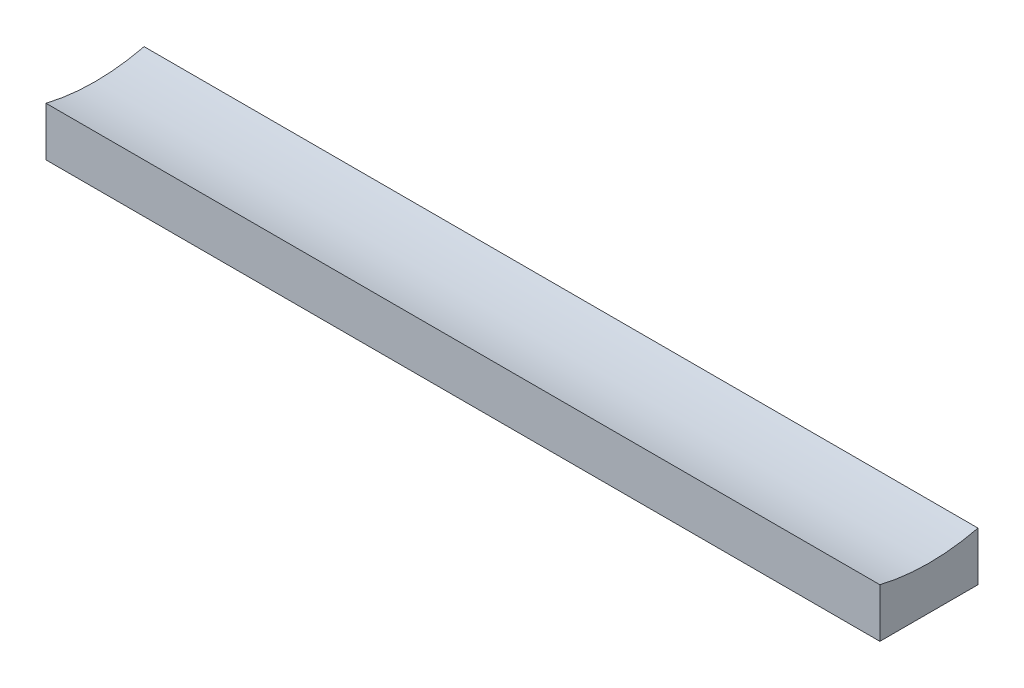
from build123d import *

# Parameters (mm, degrees)
FACE_SKETCH_W      = 170
FACE_SKETCH_H      = 20
FACE_EXTRUDE_DEPTH = 10
PROFILE_SKETCH_R   = 42.5
PROFILE_CUT_DEPTH  = 170


with BuildPart() as part:
    # Face Sketch → Face Extrude (new body)
    with BuildSketch(Plane(origin=(0, 0, 0), x_dir=(1, 0, 0), z_dir=(0, 1, 0))):
        Rectangle(FACE_SKETCH_W, FACE_SKETCH_H)
    extrude(amount=FACE_EXTRUDE_DEPTH)

    # Profile Sketch → Profile Cut (cut)
    with BuildSketch(Plane(origin=(85, 0, 0), x_dir=(0, 0, -1), z_dir=(1, 0, 0))):
        with Locations((0, 51.306779105)):
            Circle(PROFILE_SKETCH_R)
    extrude(amount=-PROFILE_CUT_DEPTH, mode=Mode.SUBTRACT)


solid = part.part
